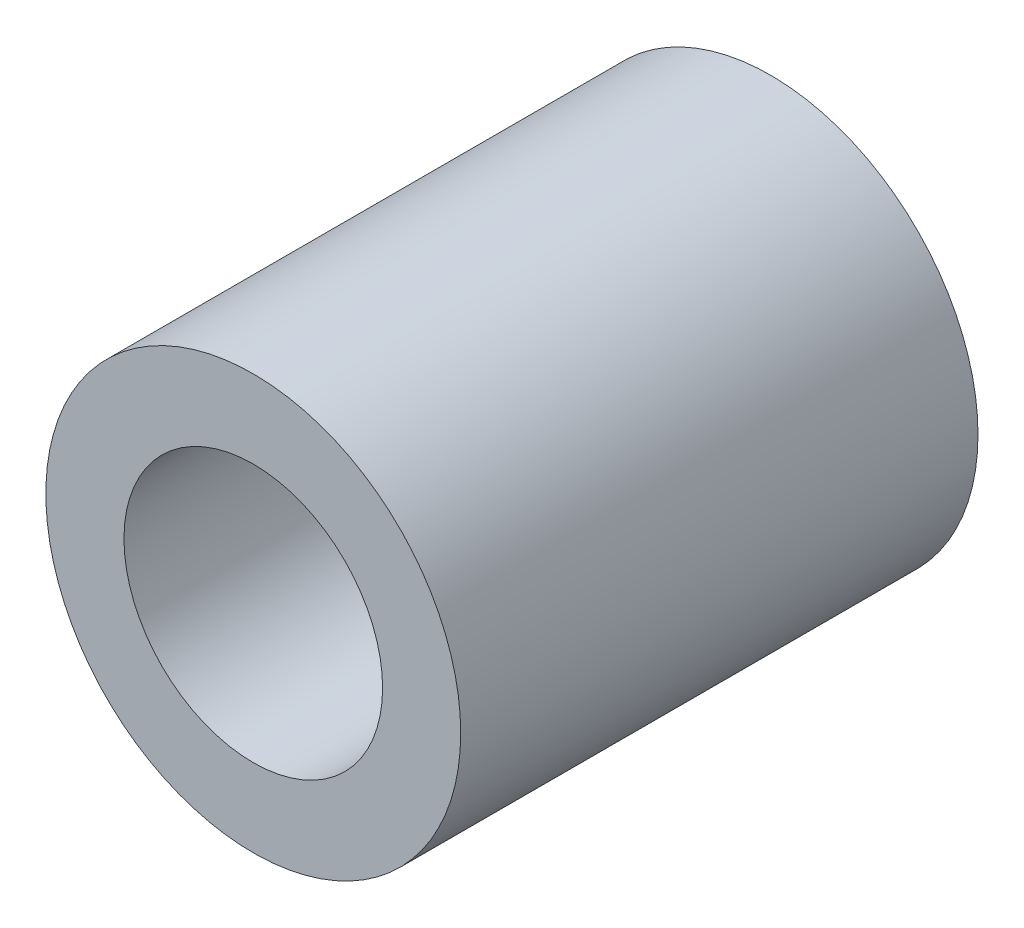
from build123d import *

# Parameters (mm, degrees)
SKETCH1_R      = 4.01
SKETCH1_R_2    = 2.5
EXTRUDE1_DEPTH = 5


with BuildPart() as part:
    # Sketch1 → Extrude1 (new, symmetric)
    with BuildSketch(Plane.XY):
        Circle(SKETCH1_R)
        Circle(SKETCH1_R_2, mode=Mode.SUBTRACT)
    extrude(amount=EXTRUDE1_DEPTH, both=True)


solid = part.part
